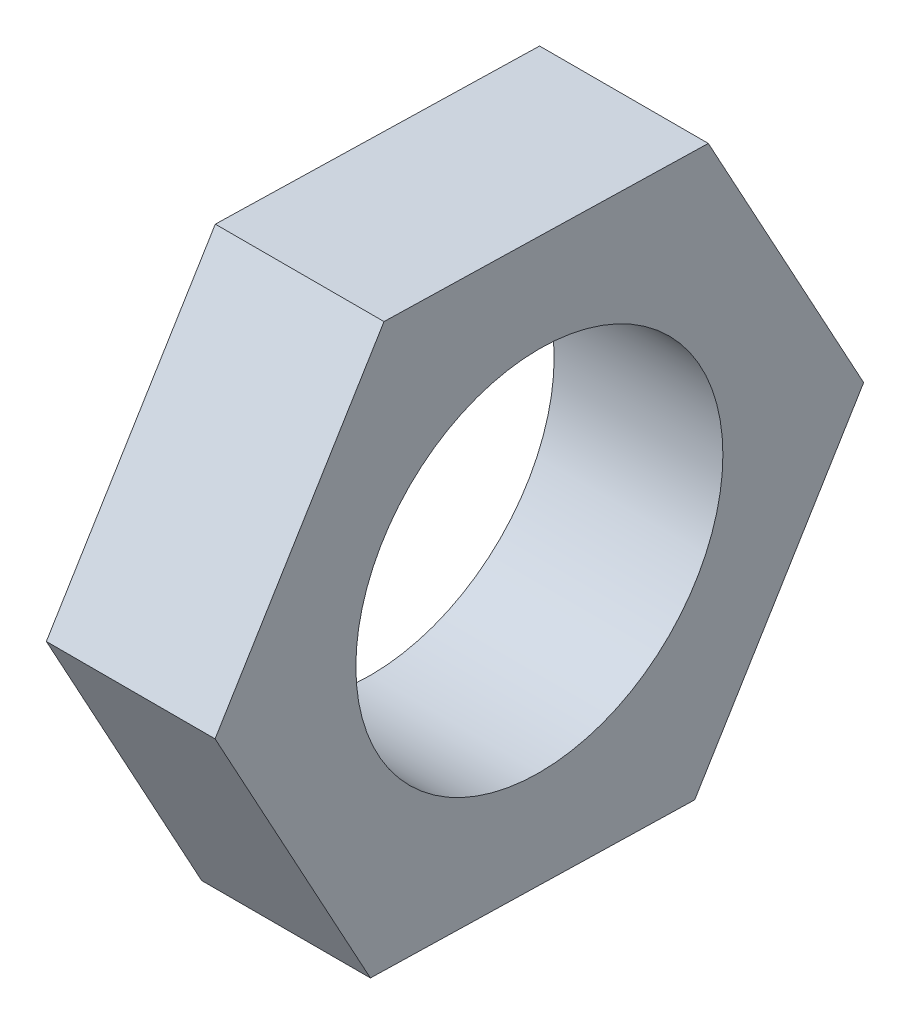
from build123d import *

# Parameters (mm, degrees)
SKETCH1_R           = 10.322814
BOSS_EXTRUDE1_DEPTH = 9.490202


with BuildPart() as part:
    # Sketch1 → Boss-Extrude1 (new body)
    with BuildSketch(Plane(origin=(0, 0, 0), x_dir=(0, 0, -1), z_dir=(1, 0, 0))):
        Polygon((345.91117, 35.58921), (354.648291413, 19.572151802), (372.888031413, 19.130191802), (382.39065, 34.70529), (373.653528587, 50.722348198), (355.413788587, 51.164308198), align=None)
        with Locations((364.15091, 35.14725)):
            Circle(SKETCH1_R, mode=Mode.SUBTRACT)
    extrude(amount=-BOSS_EXTRUDE1_DEPTH)


solid = part.part
